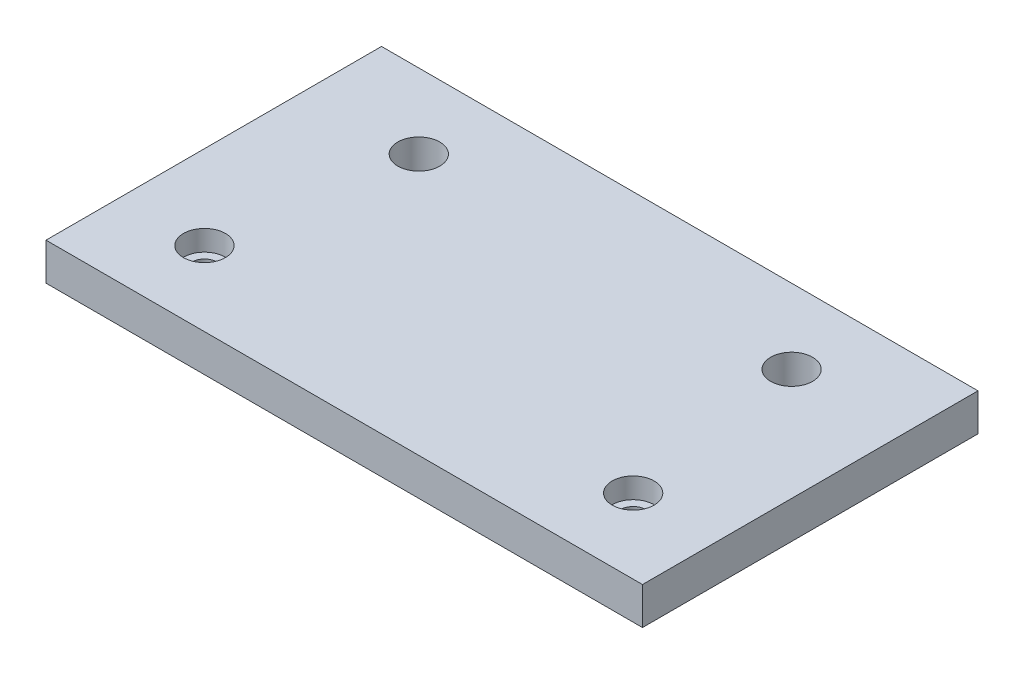
from build123d import *

# Parameters (mm, degrees)
SKETCH1_W                                      = 101.6
SKETCH1_H                                      = 57.15
BOSS_EXTRUDE1_DEPTH                            = 6.35
CBORE_FOR_6_SOCKET_HEAD_CAP_SCREW1_D           = 4.3053
CBORE_FOR_6_SOCKET_HEAD_CAP_SCREW1_CBORE_D     = 7.14502
CBORE_FOR_6_SOCKET_HEAD_CAP_SCREW1_CBORE_DEPTH = 3.5052
F_1_4_CLEARANCE_HOLE1_D                        = 7.14248


with BuildPart() as part:
    # Sketch1 → Boss-Extrude1 (new body)
    with BuildSketch(Plane(origin=(0, 0, 0), x_dir=(1, 0, 0), z_dir=(0, 1, 0))):
        with Locations((50.8, -28.575)):
            Rectangle(SKETCH1_W, SKETCH1_H)
    extrude(amount=BOSS_EXTRUDE1_DEPTH)

    # CBORE for #6 Socket Head Cap Screw1 (through all)
    with Locations(Plane(origin=(0, 6.35, 0), x_dir=(1, 0, 0), z_dir=(0, 1, 0))):
        with Locations((14.2875, -44.45), (87.3125, -44.45)):
            CounterBoreHole(CBORE_FOR_6_SOCKET_HEAD_CAP_SCREW1_D / 2, CBORE_FOR_6_SOCKET_HEAD_CAP_SCREW1_CBORE_D / 2, CBORE_FOR_6_SOCKET_HEAD_CAP_SCREW1_CBORE_DEPTH)

    # 1/4 Clearance Hole1 (through all)
    with Locations(Plane(origin=(0, 6.35, 0), x_dir=(1, 0, 0), z_dir=(0, 1, 0))):
        with Locations((19.05, -12.7), (82.55, -12.7)):
            Hole(F_1_4_CLEARANCE_HOLE1_D / 2)


solid = part.part
